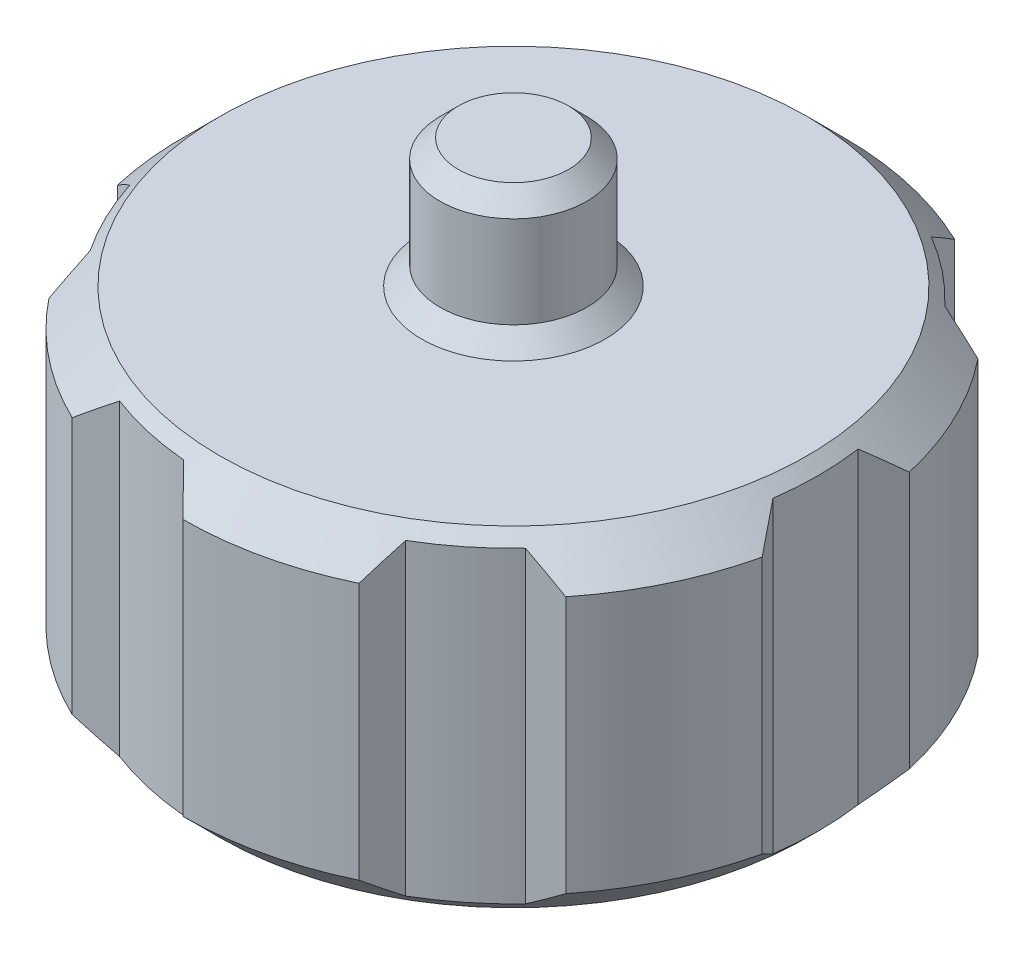
from build123d import *

# Parameters (mm, degrees)
CORTAR_EXTRUIR1_DEPTH      = 18.839562775
CORTAR_EXTRUIR1_DEPTH_BACK = 18.839562775


with BuildPart() as part:
    # Croquis1 → Revolución1 (revolve)
    with BuildSketch(Plane.XY, mode=Mode.PRIVATE) as revoluci_n1_sk:
        Polygon((0, -8), (0, 8), (-1.5, 8), (-2, 7.5), (-2, 5), (-2.5, 4.5), (-8, 4.5), (-9, 3.5), (-9, -3.5), (-8, -4.5), (-2.5, -4.5), (-2, -5), (-2, -7.5), (-1.5, -8), align=None)
    revolve(revoluci_n1_sk.sketch.rotate(Axis((0, -8, 0), (0, 1, 0)), 270), axis=Axis((0, -8, 0), (0, 1, 0)))

    # Croquis2 → Cortar-Extruir1 (cut, two sides: drawn at the far end of the back side and taken through both)
    with BuildSketch(Plane(origin=(0, 4.5, 0), x_dir=(1, 0, 0), z_dir=(0, 1, 0)).offset(-CORTAR_EXTRUIR1_DEPTH_BACK)):
        with BuildLine():
            Line((0, 9), (-0.7, 8.278295995))
            ThreePointArc((-0.7, 8.278295995), (-1.848968457, 8.099475306), (-2.961715623, 7.761985903))
            Line((-2.961715623, 7.761985903), (-3.904953652, 8.108719811))
            ThreePointArc((-3.904953652, 8.108719811), (-2.002688406, 8.77435121), (0, 9))
        make_face()
        with BuildLine():
            Line((3.904953652, 8.108719811), (4.221965458, 7.155081569))
            ThreePointArc((4.221965458, 7.155081569), (5.179611809, 6.495522003), (6.035789569, 5.708715168))
            Line((6.035789569, 5.708715168), (7.036483342, 5.611408217))
            ThreePointArc((7.036483342, 5.611408217), (5.611408217, 7.036483342), (3.904953652, 8.108719811))
        make_face()
        with BuildLine():
            Line((8.77435121, 2.002688406), (8.226420437, 1.160254876))
            ThreePointArc((8.226420437, 1.160254876), (8.307838738, 0.000308148), (8.226506485, -1.159644618))
            Line((8.226506485, -1.159644618), (8.77435121, -2.002688406))
            ThreePointArc((8.77435121, -2.002688406), (9, 0), (8.77435121, 2.002688406))
        make_face()
        with BuildLine():
            Line((7.036483342, -5.611408217), (6.036213038, -5.708267403))
            ThreePointArc((6.036213038, -5.708267403), (5.180093648, -6.495137749), (4.222496227, -7.154768354))
            Line((4.222496227, -7.154768354), (3.904953652, -8.108719811))
            ThreePointArc((3.904953652, -8.108719811), (5.611408217, -7.036483342), (7.036483342, -5.611408217))
        make_face()
        with BuildLine():
            Line((0, -9), (-0.699385895, -8.2783479))
            ThreePointArc((-0.699385895, -8.2783479), (-1.848367613, -8.099612444), (-2.961139812, -7.762205588))
            Line((-2.961139812, -7.762205588), (-3.904953652, -8.108719811))
            ThreePointArc((-3.904953652, -8.108719811), (-2.002688406, -8.77435121), (0, -9))
        make_face()
        with BuildLine():
            Line((-7.036483342, -5.611408217), (-6.908332984, -4.614663581))
            ThreePointArc((-6.908332984, -4.614663581), (-7.484970362, -3.604913767), (-7.914977177, -2.524543695))
            Line((-7.914977177, -2.524543695), (-8.77435121, -2.002688406))
            ThreePointArc((-8.77435121, -2.002688406), (-8.108719811, -3.904953652), (-7.036483342, -5.611408217))
        make_face()
        with BuildLine():
            Line((-8.77435121, 2.002688406), (-7.915164432, 2.523956536))
            ThreePointArc((-7.915164432, 2.523956536), (-7.485237762, 3.604358504), (-6.908675292, 4.614151092))
            Line((-6.908675292, 4.614151092), (-7.036483342, 5.611408217))
            ThreePointArc((-7.036483342, 5.611408217), (-8.108719811, 3.904953652), (-8.77435121, 2.002688406))
        make_face()
    extrude(amount=CORTAR_EXTRUIR1_DEPTH + CORTAR_EXTRUIR1_DEPTH_BACK, mode=Mode.SUBTRACT)


solid = part.part
